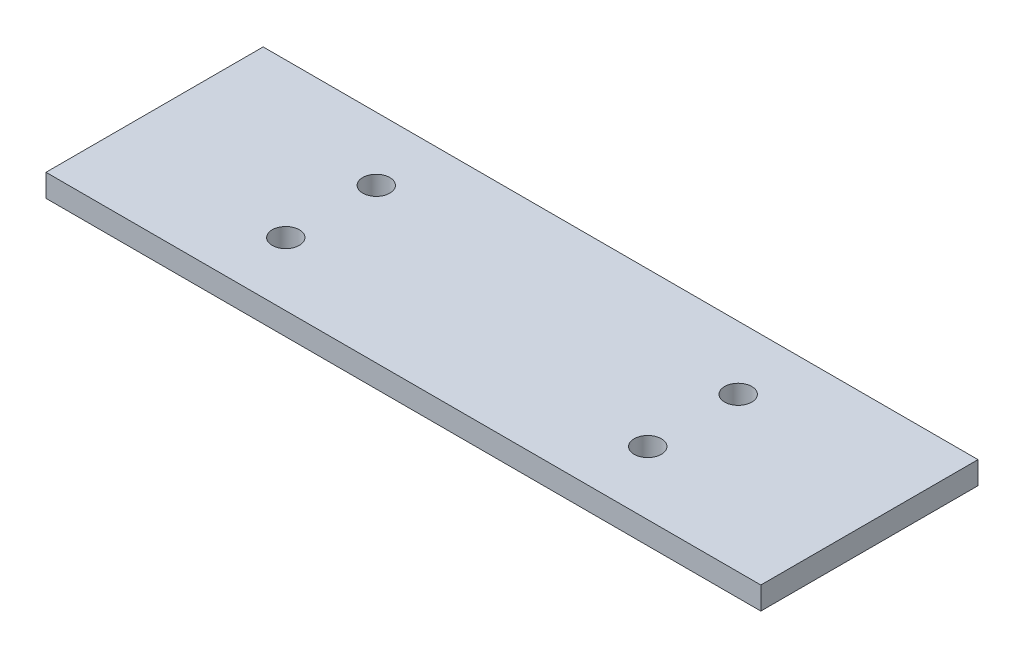
from build123d import *

# Parameters (mm, degrees)
SKIZZE1_W                       = 160
SKIZZE1_H                       = 50
SKIZZE1_R                       = 3
AUFSATZ_LINEAR_AUSTRAGEN1_DEPTH = 5
SKIZZE2_W                       = 160
SKIZZE2_H                       = 50
SKIZZE2_W_2                     = 158
SKIZZE2_H_2                     = 48
SCHNITT_LINEAR_AUSTRAGEN1_DEPTH = 10


with BuildPart() as part:
    # Skizze1 → Aufsatz-Linear austragen1 (new body)
    with BuildSketch(Plane(origin=(0, 0, 0), x_dir=(1, 0, 0), z_dir=(0, 1, 0))):
        Rectangle(SKIZZE1_W, SKIZZE1_H)
        with Locations(Location((-40, 10, 0), (0, 0, 270))):
            Circle(SKIZZE1_R, mode=Mode.SUBTRACT)
        with Locations(Location((-40, -10, 0), (0, 0, 270))):
            Circle(SKIZZE1_R, mode=Mode.SUBTRACT)
        with Locations(Location((40, 10, 0), (0, 0, 270))):
            Circle(SKIZZE1_R, mode=Mode.SUBTRACT)
        with Locations(Location((40, -10, 0), (0, 0, 270))):
            Circle(SKIZZE1_R, mode=Mode.SUBTRACT)
    extrude(amount=AUFSATZ_LINEAR_AUSTRAGEN1_DEPTH)

    # Skizze2 → Schnitt-Linear austragen1 (cut)
    with BuildSketch(Plane(origin=(0, 5, 0), x_dir=(1, 0, 0), z_dir=(0, 1, 0))):
        Rectangle(SKIZZE2_W, SKIZZE2_H)
        Rectangle(SKIZZE2_W_2, SKIZZE2_H_2, mode=Mode.SUBTRACT)
    extrude(amount=-SCHNITT_LINEAR_AUSTRAGEN1_DEPTH, mode=Mode.SUBTRACT)


solid = part.part
